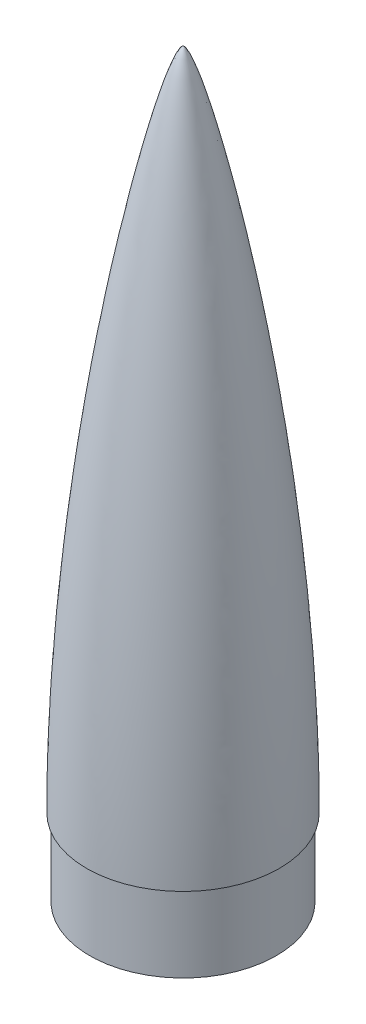
from build123d import *


with BuildPart() as part:
    # Esboço1 → Revolução1 (revolve)
    with BuildSketch(Plane.XY, mode=Mode.PRIVATE) as revolu_o1_sk:
        with BuildLine():
            Line((31.5, 0), (31.5, 26))
            Line((31.5, 26), (32.5, 26))
            add(Edge.make_bspline(
                [(32.5, 26), (32.5, 136), (5, 250), (0, 250)],
                knots=[0, 0, 0, 0, 1, 1, 1, 1], degree=3))
            Line((0, 250), (0, 217.362983304))
            Line((0, 217.362983304), (9.251837337, 217.362983304))
            add(Edge.make_bspline(
                [(31.055550101, 27.25), (32.565147741, 97.034066377), (16.88169364, 189.386843526), (9.251837337, 217.362983304)],
                knots=[0, 0, 0, 0, 1, 1, 1, 1], degree=3))
            Line((31.055550101, 27.25), (30.25, 27.25))
            Line((30.25, 27.25), (30.25, 1.25))
            Line((30.25, 1.25), (30.25, 0))
            Line((30.25, 0), (31.5, 0))
        make_face()
    revolve(revolu_o1_sk.sketch.rotate(Axis((0, 0, 0), (0, 1, 0)), 90), axis=Axis((0, 0, 0), (0, 1, 0)))


solid = part.part
